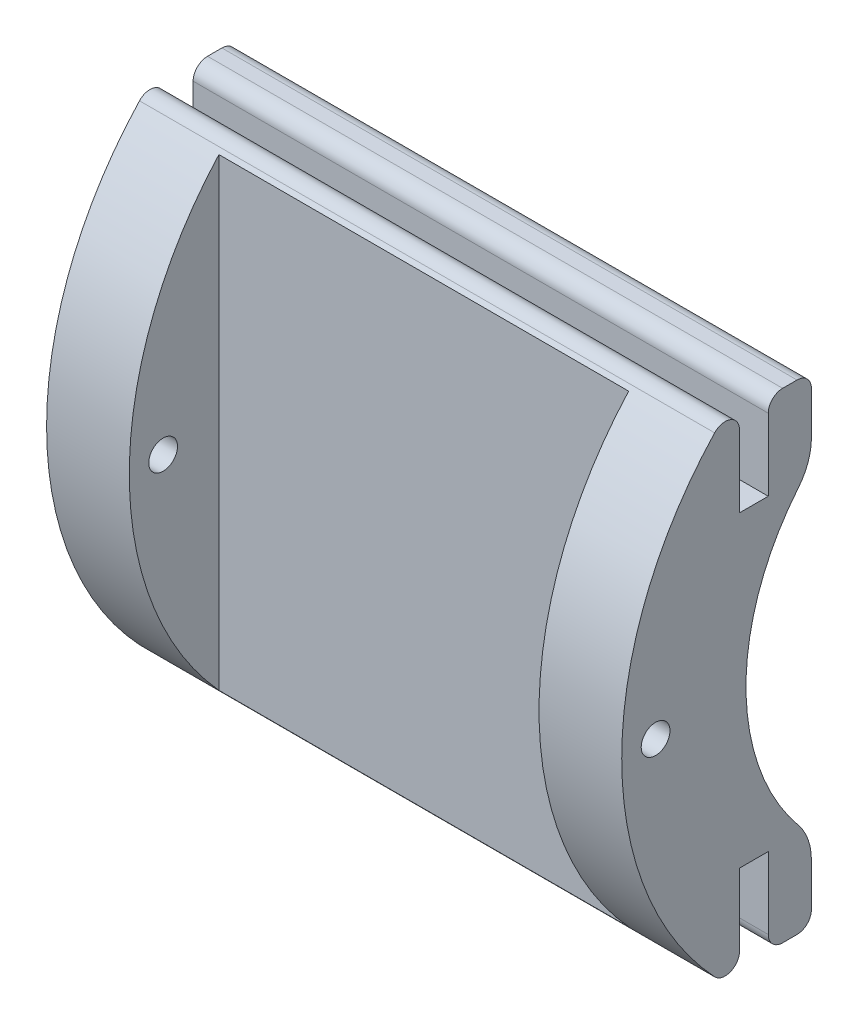
from build123d import *

# Parameters (mm, degrees)
SKETCH2_R               = 5
BOSS_EXTRUDE1_DEPTH     = 200
CUT_EXTRUDE1_DEPTH      = 221.996480462
CUT_EXTRUDE1_DEPTH_BACK = 221.996480462
SKETCH3_W               = 142.494389282
SKETCH3_H               = 38.776173082


with BuildPart() as part:
    # Sketch2 → Boss-Extrude1 (new body)
    with BuildSketch(Plane.YZ):
        with BuildLine():
            Line((-63.5, -22.748786417), (-78.5, -22.748786417))
            ThreePointArc((-78.5, -22.748786417), (-82.035533906, -21.284320323), (-83.5, -17.748786417))
            Line((-83.5, -17.748786417), (-83.5, -12.748786417))
            ThreePointArc((-83.5, -12.748786417), (-82.035533906, -9.213252511), (-78.5, -7.748786417))
            Line((-78.5, -7.748786417), (-53.5, -7.748786417))
            Line((-53.5, -7.748786417), (-53.5, 2.251213583))
            Line((-53.5, 2.251213583), (-78.5, 2.251213583))
            ThreePointArc((-78.5, 2.251213583), (-83.151322497, 5.416765702), (-81.913043478, 10.905133973))
            ThreePointArc((-81.913043478, 10.905133973), (0, 43.211044616), (81.913043478, 10.905133973))
            ThreePointArc((81.913043478, 10.905133973), (83.151322497, 5.416765702), (78.5, 2.251213583))
            Line((78.5, 2.251213583), (53.5, 2.251213583))
            Line((53.5, 2.251213583), (53.5, -7.748786417))
            Line((53.5, -7.748786417), (78.5, -7.748786417))
            ThreePointArc((78.5, -7.748786417), (82.035533906, -9.213252511), (83.5, -12.748786417))
            Line((83.5, -12.748786417), (83.5, -17.748786417))
            ThreePointArc((83.5, -17.748786417), (82.035533906, -21.284320323), (78.5, -22.748786417))
            Line((78.5, -22.748786417), (63.5, -22.748786417))
            ThreePointArc((63.5, -22.748786417), (56.754811134, -21.577021257), (50.8, -18.199029134))
            ThreePointArc((50.8, -18.199029134), (0, 0), (-50.8, -18.199029134))
            ThreePointArc((-50.8, -18.199029134), (-56.754811134, -21.577021257), (-63.5, -22.748786417))
        make_face()
        with Locations(Location((0, 31.437967685, 0), (0, 0, 270))):
            Circle(SKETCH2_R, mode=Mode.SUBTRACT)
    extrude(amount=BOSS_EXTRUDE1_DEPTH)

    # Sketch3 → Cut-Extrude1 (cut, two sides: drawn at the far end of the back side and taken through both)
    with BuildSketch(Plane(origin=(0, 0, 0), x_dir=(-1, 0, 0), z_dir=(0, 1, 0)).offset(-CUT_EXTRUDE1_DEPTH_BACK)):
        with Locations((-100, 31.437967685)):
            Rectangle(SKETCH3_W, SKETCH3_H)
    extrude(amount=CUT_EXTRUDE1_DEPTH + CUT_EXTRUDE1_DEPTH_BACK, mode=Mode.SUBTRACT)


solid = part.part
